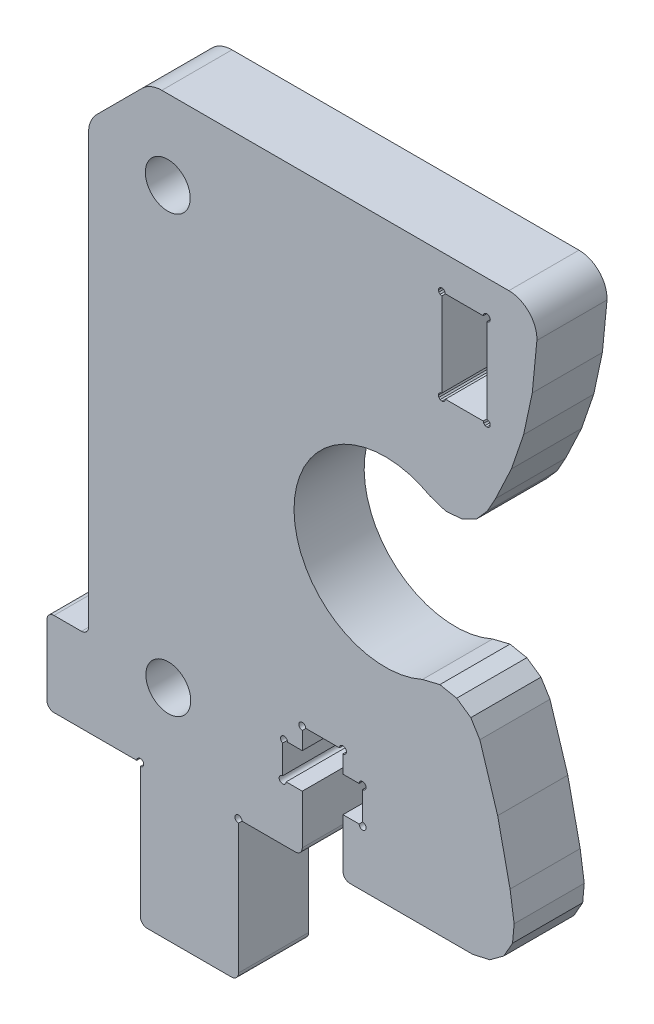
from build123d import *

# Parameters (mm, degrees)
ESQUISSE1_R        = 1.6
BOSS_EXTRU_1_DEPTH = 5


with BuildPart() as part:
    # Esquisse1 → Boss.-Extru.1 (new body)
    with BuildSketch(Plane(origin=(0, 0, 0), x_dir=(-1, 0, 0), z_dir=(0, 0, -1))):
        with BuildLine():
            Line((-34.923591431, 50.185646262), (-34.593521354, 46.781705469))
            Line((-34.593521354, 46.781705469), (-33.97698121, 43.895774796))
            Line((-33.97698121, 43.895774796), (-33.105501007, 41.345514202))
            Line((-33.105501007, 41.345514202), (-31.977290744, 38.953213644))
            Line((-31.977290744, 38.953213644), (-31.383990606, 37.884363395))
            Line((-31.383990606, 37.884363395), (-30.617930427, 37.00766319))
            Line((-30.617930427, 37.00766319), (-29.575780184, 36.488623069))
            Line((-29.575780184, 36.488623069), (-28.414519914, 36.40541305))
            Line((-28.414519914, 36.40541305), (-27.309019656, 36.770573135))
            ThreePointArc((-27.309019656, 36.770573135), (-17.618450893, 31.41303394), (-26.770699625, 25.180322464))
            Line((-26.770699625, 25.180322464), (-28.005176529, 25.48125594))
            Line((-28.005176529, 25.48125594), (-29.206336809, 25.243975885))
            Line((-29.206336809, 25.243975885), (-30.212657043, 24.546555722))
            Line((-30.212657043, 24.546555722), (-30.856527193, 23.50514548))
            Line((-30.856527193, 23.50514548), (-32.12730749, 19.451734535))
            Line((-32.12730749, 19.451734535), (-33.010967696, 15.362733581))
            Line((-33.010967696, 15.362733581), (-33.301107763, 13.363943115))
            Line((-33.301107763, 13.363943115), (-33.187947737, 12.109172823))
            Line((-33.187947737, 12.109172823), (-32.569567593, 11.011512567))
            Line((-32.569567593, 11.011512567), (-31.555037356, 10.264542393))
            Line((-31.555037356, 10.264542393), (-30.323257069, 10.000002331))
            Line((-30.323257069, 10.000002331), (-21.600005036, 10.000002331))
            ThreePointArc((-21.600005036, 10.000002331), (-21.246451562, 10.146448975), (-21.100004919, 10.500002448))
            Line((-21.100004919, 10.500002448), (-21.100004919, 14.000002331))
            Line((-21.100004919, 14.000002331), (-22.250004919, 14.000002331))
            ThreePointArc((-22.250004919, 14.000002331), (-22.676781614, 13.823225636), (-22.500004919, 14.250002331))
            Line((-22.500004919, 14.250002331), (-22.500004919, 16.250002331))
            ThreePointArc((-22.500004919, 16.250002331), (-22.676781614, 16.676779027), (-22.250004919, 16.500002331))
            Line((-22.250004919, 16.500002331), (-21.100004919, 16.500002331))
            Line((-21.100004919, 16.500002331), (-21.100004919, 17.750004196))
            ThreePointArc((-21.100004919, 17.750004196), (-21.276780955, 18.176781551), (-20.850004919, 18.000002331))
            Line((-20.850004919, 18.000002331), (-18.450004919, 18.000002331))
            ThreePointArc((-18.450004919, 18.000002331), (-18.023228224, 18.176779027), (-18.200004919, 17.750002331))
            Line((-18.200004919, 17.750002331), (-18.200004919, 16.500002331))
            Line((-18.200004919, 16.500002331), (-17.15000394, 16.500002331))
            ThreePointArc((-17.15000394, 16.500002331), (-16.763072854, 16.709167045), (-16.800004919, 16.270873119))
            Line((-16.800004919, 16.270873119), (-16.800004919, 14.250002331))
            ThreePointArc((-16.800004919, 14.250002331), (-16.623228224, 13.823225636), (-17.050004919, 14.000002331))
            Line((-17.050004919, 14.000002331), (-18.200004919, 14.000002331))
            Line((-18.200004919, 14.000002331), (-18.200004919, 10.500002448))
            ThreePointArc((-18.200004919, 10.500002448), (-18.053558275, 10.146448975), (-17.700004802, 10.000002331))
            Line((-17.700004802, 10.000002331), (-13.900003182, 10.000002331))
            ThreePointArc((-13.900003182, 10.000002331), (-13.473226487, 10.176779027), (-13.650003182, 9.750002331))
            Line((-13.650003182, 9.750002331), (-13.650003182, 0.500000117))
            ThreePointArc((-13.650003182, 0.500000117), (-13.503556539, 0.146446644), (-13.150003066, 0))
            Line((-13.150003066, 0), (-7.150001767, 0))
            ThreePointArc((-7.150001767, 0), (-6.796448223, 0.146446673), (-6.65000155, 0.500000217))
            Line((-6.65000155, 0.500000217), (-6.65000155, 9.750002273))
            Line((-6.65000155, 9.750002273), (-6.775001579, 9.783495281))
            Line((-6.775001579, 9.783495281), (-6.866507601, 9.875002302))
            Line((-6.866507601, 9.875002302), (-6.900001609, 10.000002331))
            Line((-6.900001609, 10.000002331), (-6.866507601, 10.12500236))
            Line((-6.866507601, 10.12500236), (-6.775001579, 10.216512382))
            Line((-6.775001579, 10.216512382), (-6.65000155, 10.25000239))
            Line((-6.65000155, 10.25000239), (-6.525001521, 10.216512382))
            Line((-6.525001521, 10.216512382), (-6.4334955, 10.12500236))
            Line((-6.4334955, 10.12500236), (-6.400001492, 10.000002331))
            Line((-6.400001492, 10.000002331), (-0.500000117, 10.000002331))
            ThreePointArc((-0.500000117, 10.000002331), (-0.146446644, 10.146448975), (0, 10.500002448))
            Line((0, 10.500002448), (0, 15.500002215))
            ThreePointArc((0, 15.500002215), (-0.146446644, 15.853555688), (-0.500000117, 16.000002331))
            Line((-0.500000117, 16.000002331), (-2.461443863, 16.000002331))
            ThreePointArc((-2.461443863, 16.000002331), (-2.814997336, 16.146448975), (-2.96144398, 16.500002448))
            Line((-2.96144398, 16.500002448), (-2.96144398, 47.033035527))
            ThreePointArc((-2.96144398, 47.033035527), (-3.113686629, 47.798409924), (-3.547236949, 48.44726269))
            Line((-3.547236949, 48.44726269), (-6.775657869, 51.67567661))
            ThreePointArc((-6.775657869, 51.67567661), (-7.42450983, 52.109224866), (-8.18988253, 52.261466746))
            Line((-8.18988253, 52.261466746), (-32.925020965, 52.261466746))
            ThreePointArc((-32.925020965, 52.261466746), (-34.365794593, 51.648615258), (-34.923591431, 50.185646262))
        make_face()
        with Locations((-8.611451235, 46.611460467)):
            Circle(ESQUISSE1_R, mode=Mode.SUBTRACT)
        with Locations((-8.650001767, 15.611460467)):
            Circle(ESQUISSE1_R, mode=Mode.SUBTRACT)
        Polygon((-31.600007367, 43.300010094), (-31.566507359, 43.425010123), (-31.475007338, 43.516520145), (-31.350007308, 43.550010153), (-31.350007308, 49.550011551), (-31.475007338, 49.583511559), (-31.566507359, 49.67501158), (-31.600007367, 49.80001161), (-31.566507359, 49.925011639), (-31.475007338, 50.01652166), (-31.350007308, 50.050011668), (-31.225007279, 50.01652166), (-31.133507258, 49.925011639), (-31.10000725, 49.80001161), (-28.400006621, 49.80001161), (-28.366516613, 49.925011639), (-28.275006592, 50.01652166), (-28.150006562, 50.050011668), (-28.025006533, 50.01652166), (-27.933496512, 49.925011639), (-27.900006504, 49.80001161), (-27.933496512, 49.67501158), (-28.025006533, 49.583511559), (-28.150006562, 49.550011551), (-28.150006562, 43.550010153), (-28.025006533, 43.516520145), (-27.933496512, 43.425010123), (-27.900006504, 43.300010094), (-27.933496512, 43.175010065), (-28.025006533, 43.083510044), (-28.150006562, 43.050010036), (-28.275006592, 43.083510044), (-28.366516613, 43.175010065), (-28.400006621, 43.300010094), (-31.10000725, 43.300010094), (-31.133507258, 43.175010065), (-31.225007279, 43.083510044), (-31.350007308, 43.050010036), (-31.475007338, 43.083510044), (-31.566507359, 43.175010065), align=None, mode=Mode.SUBTRACT)
    extrude(amount=-BOSS_EXTRU_1_DEPTH)


solid = part.part
